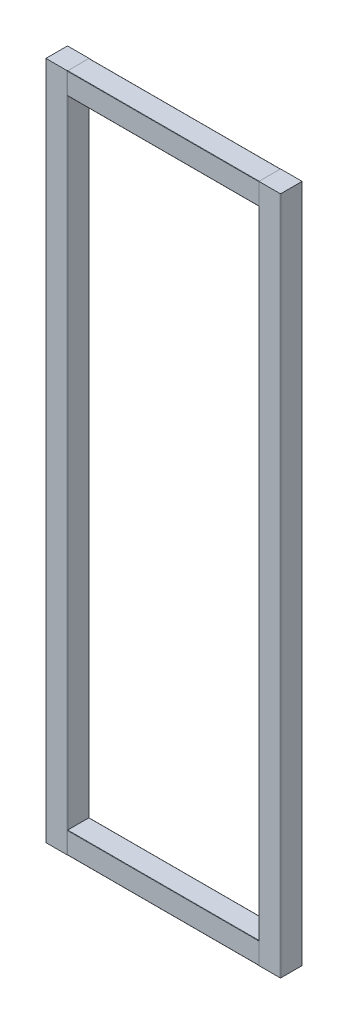
from build123d import *

# Parameters (mm, degrees)
CUSTOM_TASSEAU_CARRE_33_1_DEPTH      = 1082.5
CUSTOM_TASSEAU_CARRE_33_1_DEPTH_BACK = 17.5
CUSTOM_TASSEAU_CARRE_33_1_2_DEPTH    = 1100
CUSTOM_TASSEAU_CARRE_33_1_3_DEPTH    = 347
CUSTOM_TASSEAU_CARRE_33_1_4_DEPTH    = 347


with BuildPart() as part:
    # Esquisse14 → Custom TASSEAU-CARRE-33(1) (new, two sides: drawn at the far end of the back side and taken through both)
    with BuildSketch(Plane(origin=(172.5, -532.5, 0), x_dir=(-1, 0, 0), z_dir=(0, 1, 0)).offset(-CUSTOM_TASSEAU_CARRE_33_1_DEPTH_BACK)):
        with BuildLine():
            Line((-17, -17.5), (17, -17.5))
            ThreePointArc((17, -17.5), (17.353553391, -17.353553391), (17.5, -17))
            Line((17.5, -17), (17.5, 17))
            ThreePointArc((17.5, 17), (17.353553391, 17.353553391), (17, 17.5))
            Line((17, 17.5), (-17, 17.5))
            ThreePointArc((-17, 17.5), (-17.353553391, 17.353553391), (-17.5, 17))
            Line((-17.5, 17), (-17.5, -17))
            ThreePointArc((-17.5, -17), (-17.353553391, -17.353553391), (-17, -17.5))
        make_face()
    extrude(amount=CUSTOM_TASSEAU_CARRE_33_1_DEPTH + CUSTOM_TASSEAU_CARRE_33_1_DEPTH_BACK)


with BuildPart() as body_2:
    # Esquisse14 on segment 2 (carried to segment 2) → Custom TASSEAU-CARRE-33_1 2 (new body)
    with BuildSketch(Plane(origin=(-172.5, -550, 0), x_dir=(-1, 0, 0), z_dir=(0, 1, 0))):
        with BuildLine():
            Line((-17, -17.5), (17, -17.5))
            ThreePointArc((17, -17.5), (17.353553391, -17.353553391), (17.5, -17))
            Line((17.5, -17), (17.5, 17))
            ThreePointArc((17.5, 17), (17.353553391, 17.353553391), (17, 17.5))
            Line((17, 17.5), (-17, 17.5))
            ThreePointArc((-17, 17.5), (-17.353553391, 17.353553391), (-17.5, 17))
            Line((-17.5, 17), (-17.5, -17))
            ThreePointArc((-17.5, -17), (-17.353553391, -17.353553391), (-17, -17.5))
        make_face()
    extrude(amount=CUSTOM_TASSEAU_CARRE_33_1_2_DEPTH)


with BuildPart() as body_3:
    # Esquisse14 on segment 3 (carried to segment 3) → Custom TASSEAU-CARRE-33_1 3 (new body)
    with BuildSketch(Plane(origin=(173.5, 532.5, 0), x_dir=(0, -1, 0), z_dir=(-1, 0, 0))):
        with BuildLine():
            Line((-17, -17.5), (17, -17.5))
            ThreePointArc((17, -17.5), (17.353553391, -17.353553391), (17.5, -17))
            Line((17.5, -17), (17.5, 17))
            ThreePointArc((17.5, 17), (17.353553391, 17.353553391), (17, 17.5))
            Line((17, 17.5), (-17, 17.5))
            ThreePointArc((-17, 17.5), (-17.353553391, 17.353553391), (-17.5, 17))
            Line((-17.5, 17), (-17.5, -17))
            ThreePointArc((-17.5, -17), (-17.353553391, -17.353553391), (-17, -17.5))
        make_face()
    extrude(amount=CUSTOM_TASSEAU_CARRE_33_1_3_DEPTH)

    # Custom TASSEAU-CARRE-33_1 3 end butt 1
    split(bisect_by=Plane(origin=(155, 532.5, 0), x_dir=(0, -1, 0), z_dir=(-1, 0, 0)), keep=Keep.TOP)

    # Custom TASSEAU-CARRE-33_1 3 end butt 2
    split(bisect_by=Plane(origin=(-155, 532.5, 0), x_dir=(0, 1, 0), z_dir=(1, 0, 0)), keep=Keep.TOP)


with BuildPart() as body_4:
    # Esquisse14 on segment 4 (carried to segment 4) → Custom TASSEAU-CARRE-33_1 4 (new body)
    with BuildSketch(Plane(origin=(173.5, -532.5, 0), x_dir=(0, -1, 0), z_dir=(-1, 0, 0))):
        with BuildLine():
            Line((-17, -17.5), (17, -17.5))
            ThreePointArc((17, -17.5), (17.353553391, -17.353553391), (17.5, -17))
            Line((17.5, -17), (17.5, 17))
            ThreePointArc((17.5, 17), (17.353553391, 17.353553391), (17, 17.5))
            Line((17, 17.5), (-17, 17.5))
            ThreePointArc((-17, 17.5), (-17.353553391, 17.353553391), (-17.5, 17))
            Line((-17.5, 17), (-17.5, -17))
            ThreePointArc((-17.5, -17), (-17.353553391, -17.353553391), (-17, -17.5))
        make_face()
    extrude(amount=CUSTOM_TASSEAU_CARRE_33_1_4_DEPTH)

    # Custom TASSEAU-CARRE-33_1 4 end butt 1
    split(bisect_by=Plane(origin=(155, -532.5, 0), x_dir=(0, -1, 0), z_dir=(-1, 0, 0)), keep=Keep.TOP)

    # Custom TASSEAU-CARRE-33_1 4 end butt 2
    split(bisect_by=Plane(origin=(-155, -532.5, 0), x_dir=(0, 1, 0), z_dir=(1, 0, 0)), keep=Keep.TOP)


solid = Compound([part.part, body_2.part, body_3.part, body_4.part])
